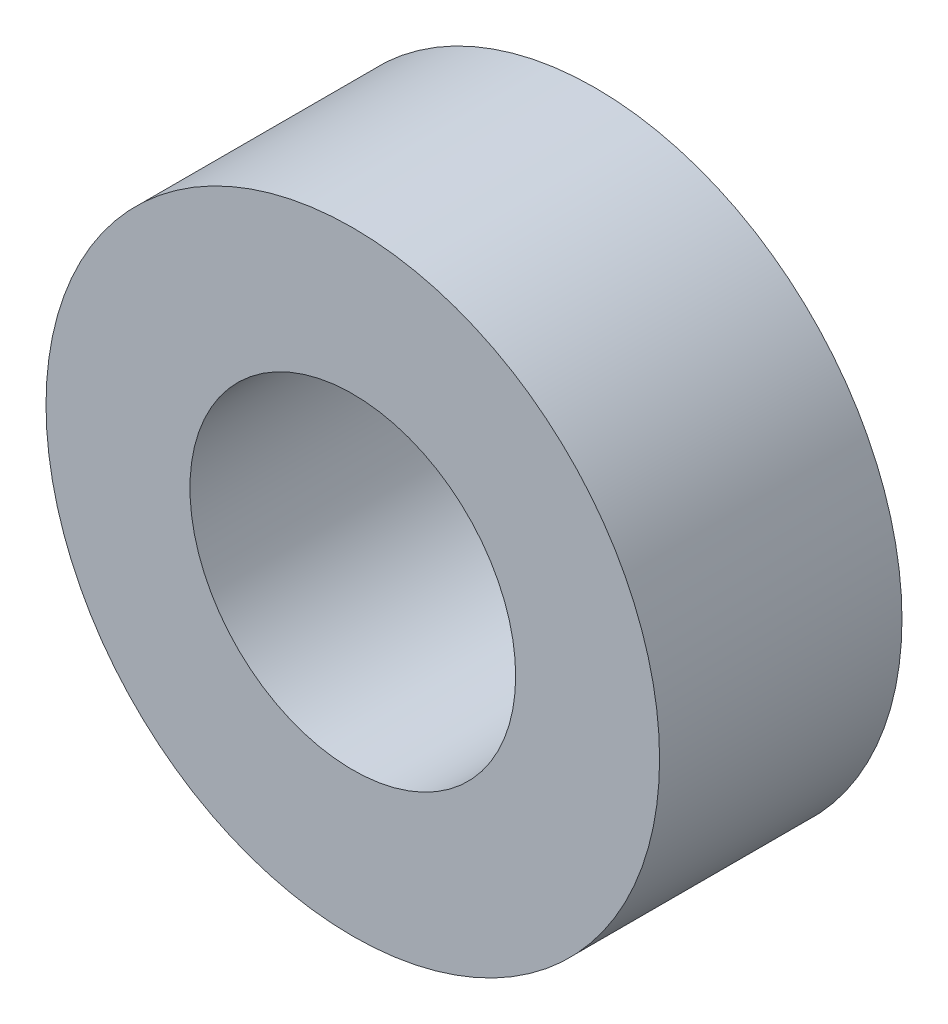
from build123d import *

# Parameters (mm, degrees)
SKETCH_1_R            = 4.05
EXTRUDE_246_DEPTH     = 3.2
SKETCH_2_R            = 2.15
CUT_EXTRUDE_315_DEPTH = 3.2


with BuildPart() as part:
    # 草图1 → Extrude 246 (new body)
    with BuildSketch(Plane.XY):
        Circle(SKETCH_1_R)
    extrude(amount=EXTRUDE_246_DEPTH)

    # 草图2 → Cut-Extrude 315 (cut)
    with BuildSketch(Plane.XY):
        Circle(SKETCH_2_R)
    extrude(amount=CUT_EXTRUDE_315_DEPTH, mode=Mode.SUBTRACT)


solid = part.part
